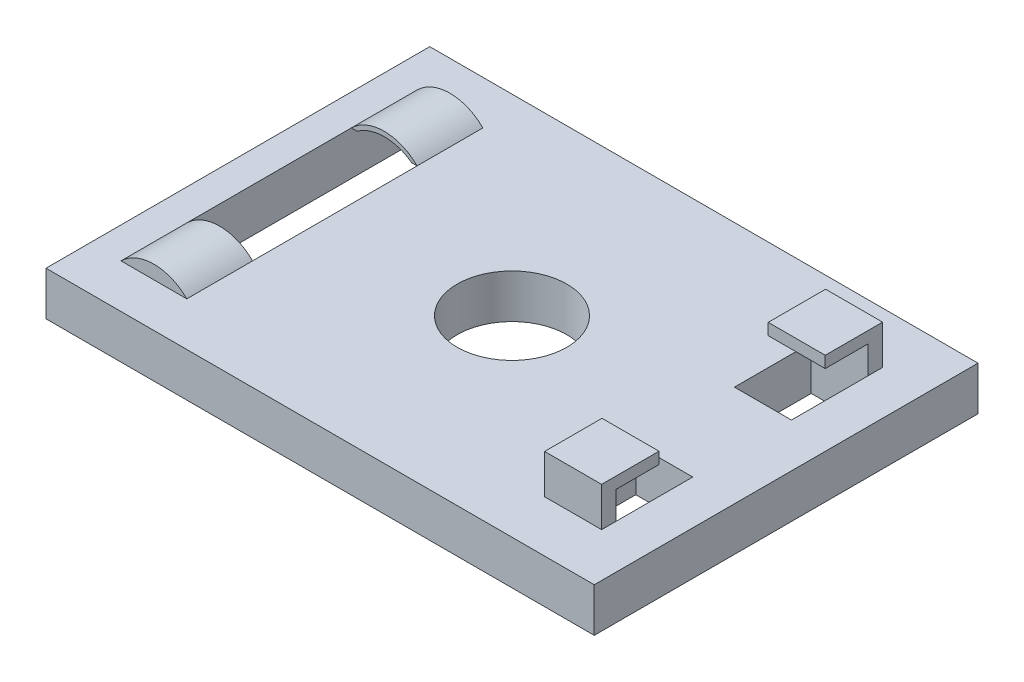
from build123d import *

# Parameters (mm, degrees)
SKETCH_1_W          = 25
SKETCH_1_H          = 17.5
EXTRUDE_1_DEPTH     = 2
SKETCH_2_R          = 2.5
CUT_EXTRUDE_1_DEPTH = 2
SKETCH_3_W          = 2.6
SKETCH_3_H          = 3.5
CUT_EXTRUDE_2_DEPTH = 2
SKETCH_4_W          = 3
SKETCH_4_H          = 13.5
CUT_EXTRUDE_3_DEPTH = 2
EXTRUDE_2_DEPTH     = 2.6
EXTRUDE_3_DEPTH     = 3
EXTRUDE_4_DEPTH     = 3
CUT_EXTRUDE_5_DEPTH = 6.5


with BuildPart() as part:
    # 草图1 → 凸台-拉伸1 (new body)
    with BuildSketch(Plane(origin=(0, 0, 0), x_dir=(1, 0, 0), z_dir=(0, 1, 0))):
        Rectangle(SKETCH_1_W, SKETCH_1_H)
    extrude(amount=EXTRUDE_1_DEPTH)

    # 草图2 → 切除-拉伸1 (cut)
    with BuildSketch(Plane(origin=(0, 2, 0), x_dir=(1, 0, 0), z_dir=(0, 1, 0))):
        with Locations(Location((0, 0, 0), (0, 0, 270))):
            Circle(SKETCH_2_R)
    extrude(amount=-CUT_EXTRUDE_1_DEPTH, mode=Mode.SUBTRACT)

    # 草图3 → 切除-拉伸2 (cut)
    with BuildSketch(Plane(origin=(0, 2, 0), x_dir=(1, 0, 0), z_dir=(0, 1, 0))):
        with Locations((9.193470991, 4)):
            Rectangle(SKETCH_3_W, SKETCH_3_H)
        with Locations((9.193470991, -4)):
            Rectangle(SKETCH_3_W, SKETCH_3_H)
    extrude(amount=-CUT_EXTRUDE_2_DEPTH, mode=Mode.SUBTRACT)

    # 草图4 → 切除-拉伸3 (cut)
    with BuildSketch(Plane(origin=(0, 2, 0), x_dir=(1, 0, 0), z_dir=(0, 1, 0))):
        with Locations((-9.578819664, 0)):
            Rectangle(SKETCH_4_W, SKETCH_4_H)
    extrude(amount=-CUT_EXTRUDE_3_DEPTH, mode=Mode.SUBTRACT)

    # 草图5 → 凸台-拉伸2 (add)
    with BuildSketch(Plane.ZY.offset(-10.493470991)):
        Polygon((-5.75, 2), (-6.406421234, 2), (-6.406421234, 3.789179116), (-3.789523296, 3.789179116), (-3.789523296, 3.263071554), (-5.75, 3.263071554), align=None)
    extrude_2 = extrude(amount=EXTRUDE_2_DEPTH)

    # 镜向1: 凸台-拉伸2 across plane
    add(extrude_2.mirror(Plane.XY))


with BuildPart() as body_2:
    # 草图6 → 凸台-拉伸3 (new body)
    with BuildSketch(Plane.XY.offset(-6.75)):
        with BuildLine():
            Line((-11.078819664, 2), (-8.078819664, 2))
            ThreePointArc((-8.078819664, 2), (-9.578819664, 2.621320344), (-11.078819664, 2))
        make_face()
    extrude(amount=EXTRUDE_3_DEPTH)


with BuildPart() as body_3:
    # 草图7 → 凸台-拉伸4 (new body)
    with BuildSketch(Plane(origin=(0, 0, 6.75), x_dir=(-1, 0, 0), z_dir=(0, 0, -1))):
        with BuildLine():
            Line((8.078819664, 2), (11.078819664, 2))
            ThreePointArc((11.078819664, 2), (9.578819664, 2.621320344), (8.078819664, 2))
        make_face()
    extrude(amount=EXTRUDE_4_DEPTH)


with BuildPart() as cut_extrude_5_tool:
    # 草图8 → 切除-拉伸5 (new, symmetric)
    with BuildSketch(Plane.XY):
        with BuildLine():
            ThreePointArc((-8.320812894, 2), (-9.569707039, 2.406914067), (-10.818601184, 2))
            Line((-10.818601184, 2), (-8.320812894, 2))
        make_face()
        with BuildLine():
            Line((-8.320812894, 2), (-10.818601184, 2))
            ThreePointArc((-10.818601184, 2), (-10.53062962, -1.60280226), (-7.449707039, 0.286914067))
            ThreePointArc((-7.449707039, 0.286914067), (-7.679990713, 1.247836648), (-8.320812894, 2))
        make_face()
    extrude(amount=CUT_EXTRUDE_5_DEPTH, both=True)


with BuildPart() as body_2_1:
    add(body_2.part)

    # 切除-拉伸5: cut by cut_extrude_5_tool
    add(cut_extrude_5_tool.part, mode=Mode.SUBTRACT)


with BuildPart() as body_3_1:
    add(body_3.part)

    # 切除-拉伸5: cut by cut_extrude_5_tool
    add(cut_extrude_5_tool.part, mode=Mode.SUBTRACT)


solid = Compound([part.part, body_2_1.part, body_3_1.part])
